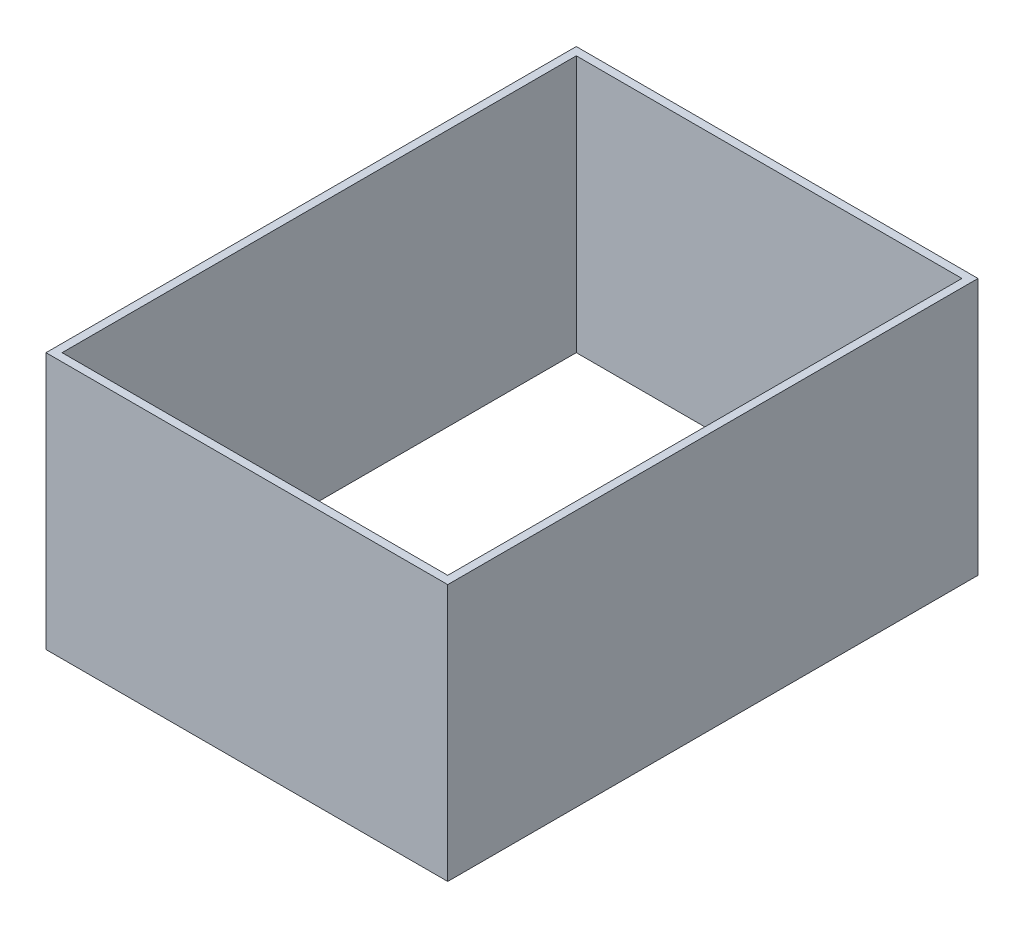
from build123d import *

# Parameters (mm, degrees)
SKETCH1_W           = 152.4
SKETCH1_H           = 203.2
BOSS_EXTRUDE1_DEPTH = 101.6
SHELL1_T            = 3.175


with BuildPart() as part:
    # Sketch1 → Boss-Extrude1 (new body)
    with BuildSketch(Plane(origin=(0, 0, 0), x_dir=(1, 0, 0), z_dir=(0, 1, 0))):
        Rectangle(SKETCH1_W, SKETCH1_H)
    extrude(amount=BOSS_EXTRUDE1_DEPTH)

    # Shell1
    shell1_openings = [part.faces().sort_by_distance(p)[0] for p in [
        (0, 0, 0),
        (0, 101.6, 0),
    ]]
    offset(amount=SHELL1_T, openings=shell1_openings, kind=Kind.INTERSECTION)


solid = part.part
